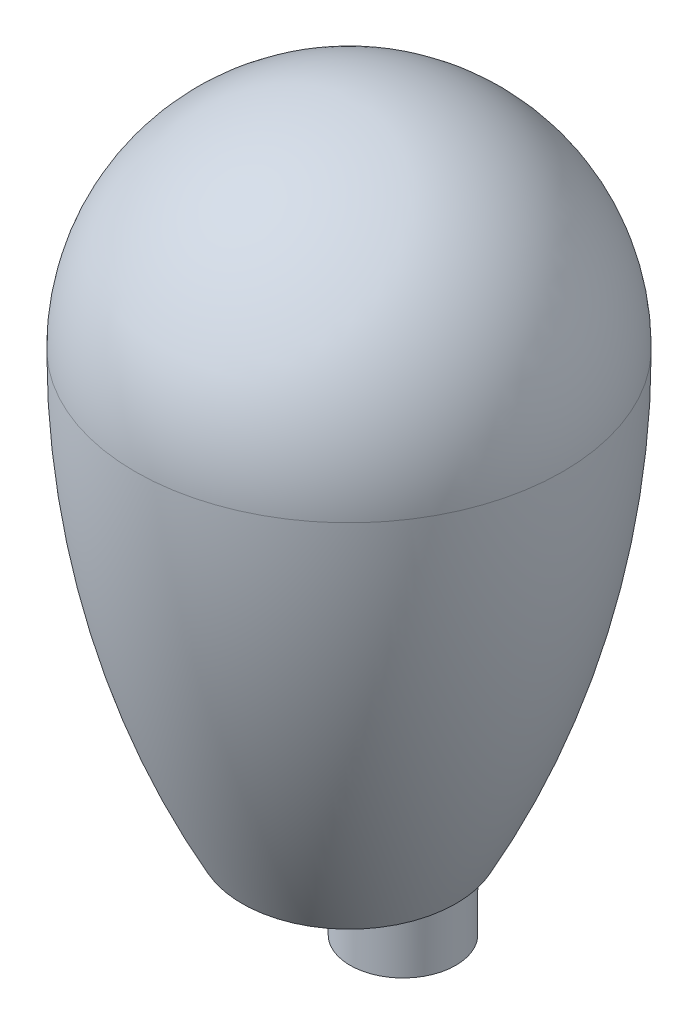
from build123d import *

# Parameters (mm, degrees)
SKETCH2_R           = 0.2475
BOSS_EXTRUDE1_DEPTH = 0.25


with BuildPart() as part:
    # Sketch1 → Revolve2 (revolve)
    with BuildSketch(Plane.XY):
        with BuildLine():
            Line((0, 0), (0, 3))
            ThreePointArc((0, 3), (0.707106781, 2.707106781), (1, 2))
            ThreePointArc((1, 2), (0.873105626, 0.969223594), (0.5, 0))
            Line((0.5, 0), (0, 0))
        make_face()
    revolve(axis=Axis((0, 0, 0), (0, 1, 0)))

    # Sketch2 → Boss-Extrude1 (add)
    with BuildSketch(Plane.XZ):
        with Locations(Location((0.2525, 0, 0), (0, 0, 359.997708054))):
            Circle(SKETCH2_R)
        with Locations(Location((-0.2525, 0, 0), (0, 0, 179.997708054))):
            Circle(SKETCH2_R)
    extrude(amount=BOSS_EXTRUDE1_DEPTH)


solid = part.part
